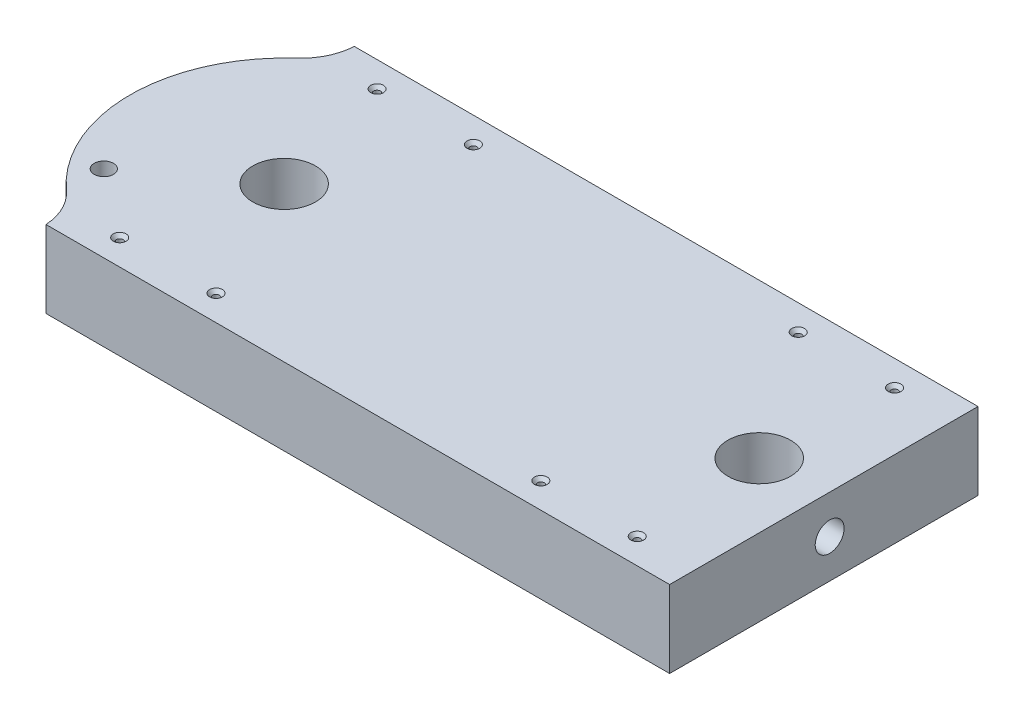
from build123d import *

# Parameters (mm, degrees)
BOSS_EXTRUDE1_DEPTH                               = 50.8
CSK_FOR_8_FLAT_HEAD_MACHINE_SCREW_100_D           = 4.4958
CSK_FOR_8_FLAT_HEAD_MACHINE_SCREW_100_CSINK_D     = 8.4328
CSK_FOR_8_FLAT_HEAD_MACHINE_SCREW_100_CSINK_ANGLE = 82
MIRROR2_COPY_1_D                                  = 4.4958
MIRROR2_COPY_1_CSINK_D                            = 8.4328
MIRROR2_COPY_1_CSINK_ANGLE                        = 82
SKETCH14_R                                        = 6.35
CUT_EXTRUDE4_DEPTH                                = 503.89434278
SKETCH15_R                                        = 20.6375
CUT_EXTRUDE5_DEPTH                                = 503.89434278
SKETCH16_R                                        = 20.6375
CUT_EXTRUDE6_DEPTH                                = 503.89434278
F_5_8_0_75_DIAMETER_HOLE1_D                       = 19.05
F_5_8_0_75_DIAMETER_HOLE1_DEPTH                   = 32.961002604
F_5_8_0_75_DIAMETER_HOLE1_TIP                     = 5.723197396


with BuildPart() as part:
    # Sketch1 → Boss-Extrude1 (new body)
    with BuildSketch(Plane(origin=(0, 0, 0), x_dir=(1, 0, 0), z_dir=(0, 1, 0))):
        with BuildLine():
            Line((0, 0), (0, -203.2))
            Line((0, -203.2), (-410.920118429, -203.2))
            ThreePointArc((-410.920118429, -203.2), (-414.643880683, -188.956317144), (-423.489894398, -177.187844516))
            ThreePointArc((-423.489894398, -177.187844516), (-457.2, -101.6), (-423.489894398, -26.012155484))
            ThreePointArc((-423.489894398, -26.012155484), (-414.643880683, -14.243682856), (-410.920118429, 0))
            Line((-410.920118429, 0), (0, 0))
        make_face()
    extrude(amount=BOSS_EXTRUDE1_DEPTH)

    # CSK for #8 Flat Head Machine Screw (100)1 (through all)
    with Locations(Plane(origin=(0, 50.8, 0), x_dir=(1, 0, 0), z_dir=(0, 1, 0))):
        with Locations((-379.170118429, -186.3852), (-315.670118429, -186.3852)):
            csk_for_8_flat_head_machine_screw_100 = CounterSinkHole(CSK_FOR_8_FLAT_HEAD_MACHINE_SCREW_100_D / 2, CSK_FOR_8_FLAT_HEAD_MACHINE_SCREW_100_CSINK_D / 2, counter_sink_angle=CSK_FOR_8_FLAT_HEAD_MACHINE_SCREW_100_CSINK_ANGLE)

    # Mirror1: CSK for #8 Flat Head Machine Screw (100)1 across plane
    add(csk_for_8_flat_head_machine_screw_100.mirror(Plane.XY.offset(101.6)), mode=Mode.SUBTRACT)

    # Mirror2: CSK for #8 Flat Head Machine Screw (100)1 across plane
    add(csk_for_8_flat_head_machine_screw_100.mirror(Plane(origin=(-208.661, 0, 0), x_dir=(0, 0, 1), z_dir=(1, 0, 0))), mode=Mode.SUBTRACT)

    # Mirror2 copy 1 (through all)
    with Locations(Plane(origin=(-417.322, 50.8, 203.2), x_dir=(-1, 0, 0), z_dir=(0, 1, 0))):
        with Locations((-379.170118429, -186.3852), (-315.670118429, -186.3852)):
            CounterSinkHole(MIRROR2_COPY_1_D / 2, MIRROR2_COPY_1_CSINK_D / 2, counter_sink_angle=MIRROR2_COPY_1_CSINK_ANGLE)

    # Sketch14 → Cut-Extrude4 (cut, through all)
    with BuildSketch(Plane(origin=(0, 50.8, 0), x_dir=(1, 0, 0), z_dir=(0, 1, 0))):
        with Locations(Location((-423.620118429, -152.4, 0), (0, 0, 270))):
            Circle(SKETCH14_R)
    extrude(amount=-CUT_EXTRUDE4_DEPTH, mode=Mode.SUBTRACT)

    # Sketch15 → Cut-Extrude5 (cut, through all)
    with BuildSketch(Plane(origin=(0, 50.8, 0), x_dir=(1, 0, 0), z_dir=(0, 1, 0))):
        with Locations(Location((-355.6, -101.6, 0), (0, 0, 270))):
            Circle(SKETCH15_R)
    extrude(amount=-CUT_EXTRUDE5_DEPTH, mode=Mode.SUBTRACT)

    # Sketch16 → Cut-Extrude6 (cut, through all)
    with BuildSketch(Plane(origin=(0, 50.8, 0), x_dir=(1, 0, 0), z_dir=(0, 1, 0))):
        with Locations(Location((-42.545, -101.6, 0), (0, 0, 270))):
            Circle(SKETCH16_R)
    extrude(amount=-CUT_EXTRUDE6_DEPTH, mode=Mode.SUBTRACT)

    # 5/8 (0.75) Diameter Hole1
    with Locations(Plane(origin=(0, 0, 0), x_dir=(0, 0, -1), z_dir=(1, 0, 0))):
        with Locations((-97.7392, 25.4)):
            Hole(F_5_8_0_75_DIAMETER_HOLE1_D / 2, depth=F_5_8_0_75_DIAMETER_HOLE1_DEPTH)
            with Locations((0, 0, -(F_5_8_0_75_DIAMETER_HOLE1_DEPTH + F_5_8_0_75_DIAMETER_HOLE1_TIP / 2))):  # 118° drill point
                Cone(0, F_5_8_0_75_DIAMETER_HOLE1_D / 2, F_5_8_0_75_DIAMETER_HOLE1_TIP, mode=Mode.SUBTRACT)


solid = part.part
